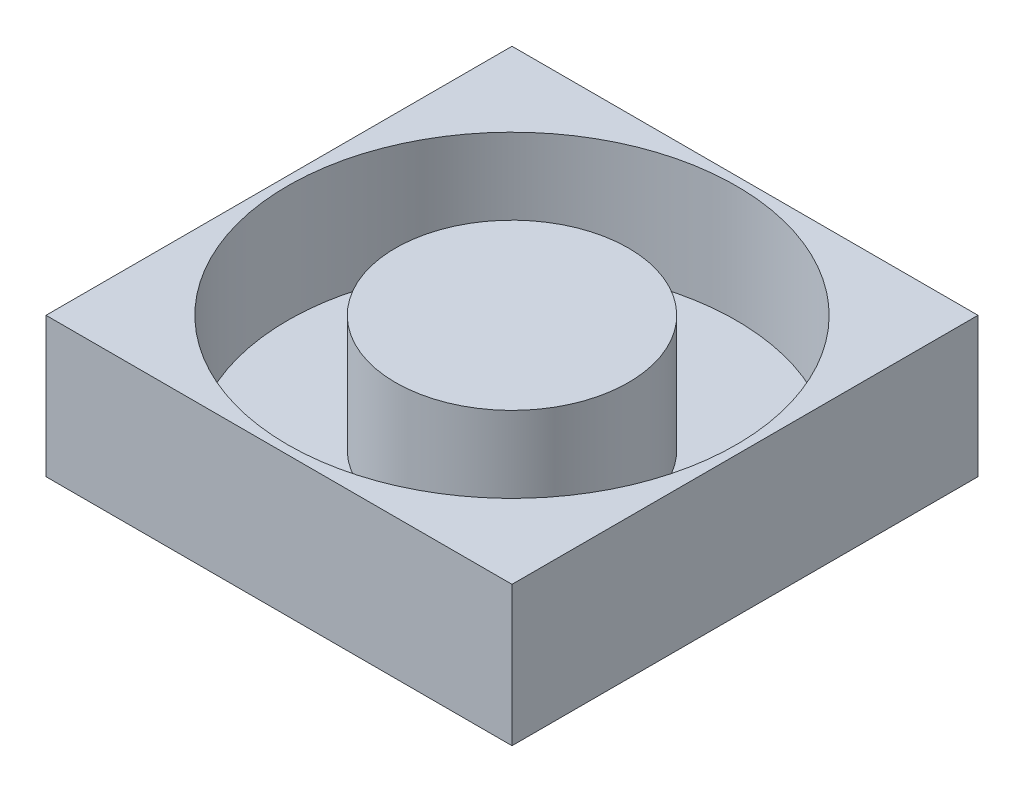
from build123d import *

# Parameters (mm, degrees)
SKETCH_1_W          = 40
SKETCH_1_H          = 40
EXTRUDE_1_DEPTH     = 12
SKETCH_2_R          = 19.25
SKETCH_2_R_2        = 10
CUT_EXTRUDE_1_DEPTH = 10


with BuildPart() as part:
    # 草图1 → 凸台-拉伸1 (new body)
    with BuildSketch(Plane(origin=(0, 0, 0), x_dir=(1, 0, 0), z_dir=(0, 1, 0))):
        with Locations((20, -20)):
            Rectangle(SKETCH_1_W, SKETCH_1_H)
    extrude(amount=EXTRUDE_1_DEPTH)

    # 草图2 → 切除-拉伸1 (cut)
    with BuildSketch(Plane(origin=(0, 12, 0), x_dir=(1, 0, 0), z_dir=(0, 1, 0))):
        with Locations(Location((20, -20, 0), (0, 0, 270))):
            Circle(SKETCH_2_R)
        with Locations(Location((20, -20, 0), (0, 0, 270))):
            Circle(SKETCH_2_R_2, mode=Mode.SUBTRACT)
    extrude(amount=-CUT_EXTRUDE_1_DEPTH, mode=Mode.SUBTRACT)


solid = part.part
